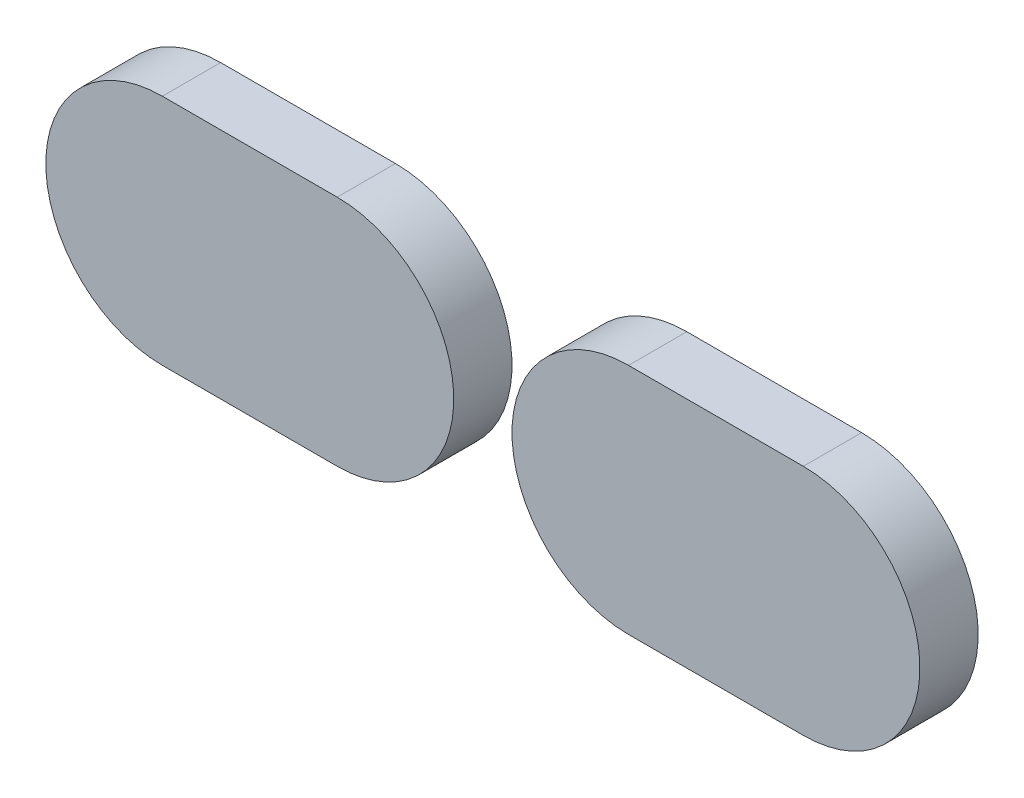
from build123d import *

# Parameters (mm, degrees)
BOSS_EXTRU_1_DEPTH   = 10
BOSS_EXTRU_1_2_DEPTH = 10


with BuildPart() as part:
    # Esquisse1 → Boss.-Extru.1 (new body)
    with BuildSketch(Plane.XY):
        with BuildLine():
            Line((0, 20), (30, 20))
            ThreePointArc((30, 20), (50, 0), (30, -20))
            Line((30, -20), (0, -20))
            ThreePointArc((0, -20), (-20, 0), (0, 20))
        make_face()
    extrude(amount=BOSS_EXTRU_1_DEPTH)


with BuildPart() as body_2:
    # Esquisse1 → Boss.-Extru.1 2 (new body)
    with BuildSketch(Plane.XY):
        with BuildLine():
            Line((80, 20), (110, 20))
            ThreePointArc((110, 20), (130, 0), (110, -20))
            Line((110, -20), (80, -20))
            ThreePointArc((80, -20), (60, 0), (80, 20))
        make_face()
    extrude(amount=BOSS_EXTRU_1_2_DEPTH)


solid = Compound([part.part, body_2.part])
